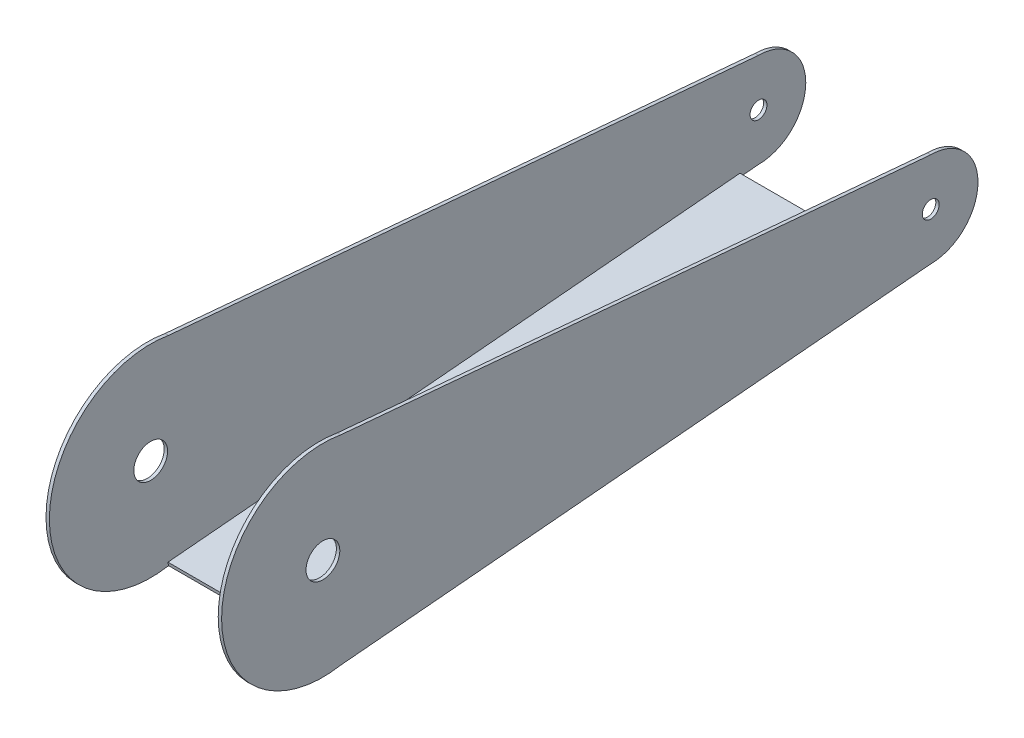
from build123d import *

# Parameters (mm, degrees)
SKETCH1_R           = 5
SKETCH1_R_2         = 2.5
BOSS_EXTRUDE1_DEPTH = 26
CUT_EXTRUDE1_DEPTH  = 25


with BuildPart() as part:
    # Sketch1 → Boss-Extrude1 (new, symmetric)
    with BuildSketch(Plane(origin=(0, 0, 0), x_dir=(0, 0, -1), z_dir=(1, 0, 0))):
        with BuildLine():
            Line((5.291523763, 29.529642332), (180, 14))
            ThreePointArc((180, 14), (194, 0), (180, -14))
            Line((180, -14), (5.291523763, -29.529642332))
            ThreePointArc((5.291523763, -29.529642332), (-30, 0), (5.291523763, 29.529642332))
        make_face()
        with Locations(Location((0, 0, 0), (0, 0, 180))):
            Circle(SKETCH1_R, mode=Mode.SUBTRACT)
        with Locations(Location((180, 0, 0), (0, 0, 180))):
            Circle(SKETCH1_R_2, mode=Mode.SUBTRACT)
    extrude(amount=BOSS_EXTRUDE1_DEPTH, both=True)

    # Sketch2 → Cut-Extrude1 (cut, symmetric)
    with BuildSketch(Plane(origin=(0, 0, 0), x_dir=(0, 0, -1), z_dir=(1, 0, 0))):
        with BuildLine():
            Line((5.291523763, -29.529642332), (5.114444182, -28.541439895))
            Line((5.114444182, -28.541439895), (174.506520913, -13.484366408))
            Line((174.506520913, -13.484366408), (174.595060704, -14.480439049))
            Line((174.595060704, -14.480439049), (180, -14))
            ThreePointArc((180, -14), (194, 0), (180, 14))
            Line((180, 14), (5.291523763, 29.529642332))
            ThreePointArc((5.291523763, 29.529642332), (-30, 0), (5.291523763, -29.529642332))
        make_face()
    extrude(amount=CUT_EXTRUDE1_DEPTH, both=True, mode=Mode.SUBTRACT)


solid = part.part
